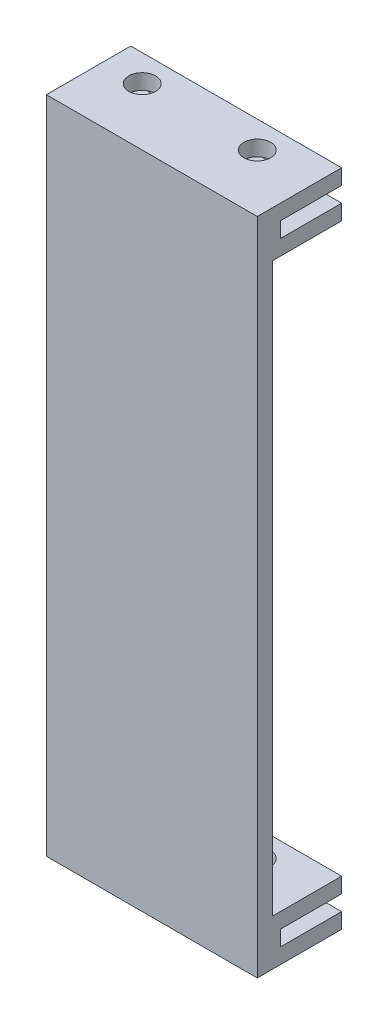
from build123d import *

# Parameters (mm, degrees)
SKETCH_1_W          = 30
SKETCH_1_H          = 11
EXTRUDE_1_DEPTH     = 6
SKETCH_2_W          = 16
SKETCH_2_H          = 2
CUT_EXTRUDE_1_DEPTH = 144
EXTRUDE_2_DEPTH     = 74
SKETCH_4_R          = 1.75
CUT_EXTRUDE_2_DEPTH = 144
SKETCH_5_W          = 11
SKETCH_5_H          = 80
CUT_EXTRUDE_3_DEPTH = 2.5
SKETCH_7_W          = 4
SKETCH_7_H          = 9
CUT_EXTRUDE_4_DEPTH = 74


with BuildPart() as part:
    # 草图1 → 凸台-拉伸1 (new body)
    with BuildSketch(Plane(origin=(0, 0, 0), x_dir=(1, 0, 0), z_dir=(0, 1, 0))):
        Rectangle(SKETCH_1_W, SKETCH_1_H)
    extrude_1 = extrude(amount=EXTRUDE_1_DEPTH)

    # 草图2 → 切除-拉伸1 (cut)
    with BuildSketch(Plane.ZY.offset(15)):
        with Locations((-5.5, 3)):
            Rectangle(SKETCH_2_W, SKETCH_2_H)
    cut_extrude_1 = extrude(amount=-CUT_EXTRUDE_1_DEPTH, mode=Mode.SUBTRACT)

    # 草图3 → 凸台-拉伸2 (add)
    with BuildSketch(Plane(origin=(0, 6, 0), x_dir=(1, 0, 0), z_dir=(0, 1, 0))):
        Polygon((2, 5.5), (-2, 5.5), (-2, -3.5), (-15, -3.5), (-15, -5.5), (15, -5.5), (15, -3.5), (2, -3.5), align=None)
    extrude(amount=EXTRUDE_2_DEPTH)

    # 草图4 → 切除-拉伸2 (cut)
    with BuildSketch(Plane(origin=(0, 6, 0), x_dir=(1, 0, 0), z_dir=(0, 1, 0))):
        with Locations(Location((-7.5, 2, 0), (0, 0, 270))):
            Circle(SKETCH_4_R)
        with Locations(Location((7.5, 2, 0), (0, 0, 270))):
            Circle(SKETCH_4_R)
    cut_extrude_2 = extrude(amount=-CUT_EXTRUDE_2_DEPTH, mode=Mode.SUBTRACT)

    # 草图5 → 切除-拉伸3 (cut)
    with BuildSketch(Plane.ZY.offset(15)):
        with Locations((0, 40)):
            Rectangle(SKETCH_5_W, SKETCH_5_H)
    cut_extrude_3 = extrude(amount=-CUT_EXTRUDE_3_DEPTH, mode=Mode.SUBTRACT)

    # 草图7 → 切除-拉伸4 (cut)
    with BuildSketch(Plane(origin=(0, 80, 0), x_dir=(1, 0, 0), z_dir=(0, 1, 0))):
        with Locations((0, 1)):
            Rectangle(SKETCH_7_W, SKETCH_7_H)
    extrude(amount=-CUT_EXTRUDE_4_DEPTH, mode=Mode.SUBTRACT)

    # 镜向1: 凸台-拉伸1, 切除-拉伸1, 切除-拉伸2, 切除-拉伸3 across plane
    add(extrude_1.mirror(Plane.ZX.offset(43)))
    add(cut_extrude_1.mirror(Plane.ZX.offset(43)), mode=Mode.SUBTRACT)
    add(cut_extrude_2.mirror(Plane.ZX.offset(43)), mode=Mode.SUBTRACT)
    add(cut_extrude_3.mirror(Plane.ZX.offset(43)), mode=Mode.SUBTRACT)


solid = part.part
